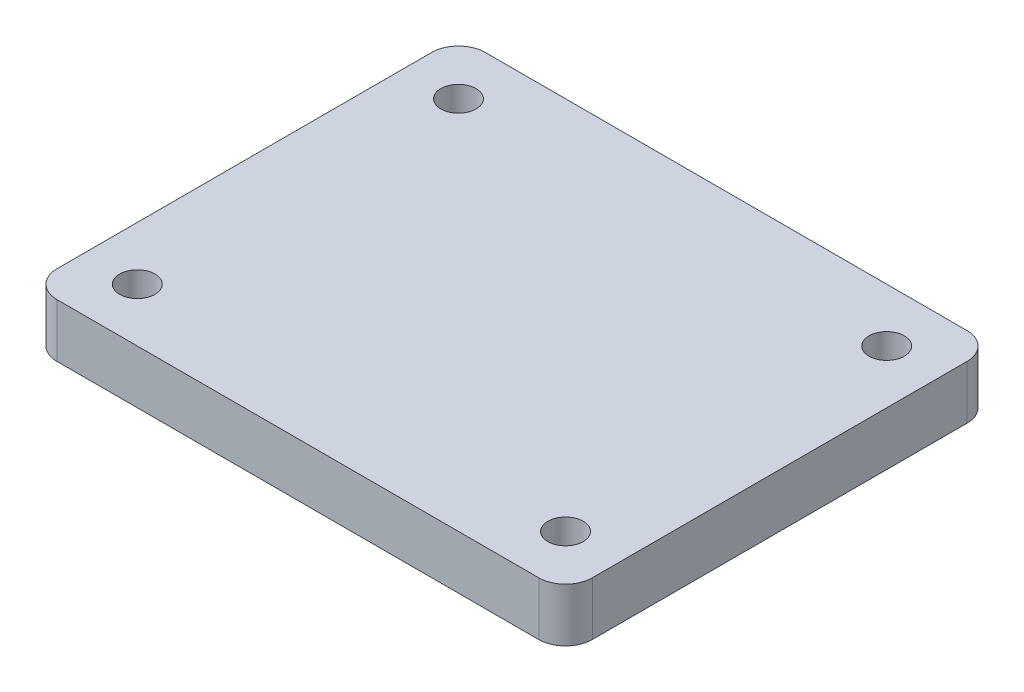
from build123d import *

# Parameters (mm, degrees)
SKETCH_1_W          = 100
SKETCH_1_H          = 80
EXTRUDE_1_DEPTH     = 10
SKETCH_2_R          = 3.3
CUT_EXTRUDE_1_DEPTH = 129.452325787
FILLET_1_R          = 5


with BuildPart() as part:
    # 草圖1 → 填料-伸長1 (new body)
    with BuildSketch(Plane(origin=(0, 0, 0), x_dir=(1, 0, 0), z_dir=(0, 1, 0))):
        with Locations((50, 40)):
            Rectangle(SKETCH_1_W, SKETCH_1_H)
    extrude(amount=EXTRUDE_1_DEPTH)

    # 草圖2 → 除料-伸長1 (cut, through all)
    with BuildSketch(Plane(origin=(0, 0, 0), x_dir=(1, 0, 0), z_dir=(0, 1, 0))):
        with Locations(Location((10, 10, 0), (0, 0, 270))):
            Circle(SKETCH_2_R)
        with Locations(Location((90, 10, 0), (0, 0, 270))):
            Circle(SKETCH_2_R)
        with Locations(Location((10, 70, 0), (0, 0, 270))):
            Circle(SKETCH_2_R)
        with Locations(Location((90, 70, 0), (0, 0, 270))):
            Circle(SKETCH_2_R)
    extrude(amount=CUT_EXTRUDE_1_DEPTH, mode=Mode.SUBTRACT)

    # 圓角1
    fillet_1_edges = [part.edges().sort_by_distance(p)[0] for p in [
        (0, 5, -80),
        (100, 5, -80),
        (100, 5, 0),
        (0, 5, 0),
    ]]
    fillet(fillet_1_edges, radius=FILLET_1_R)


solid = part.part
